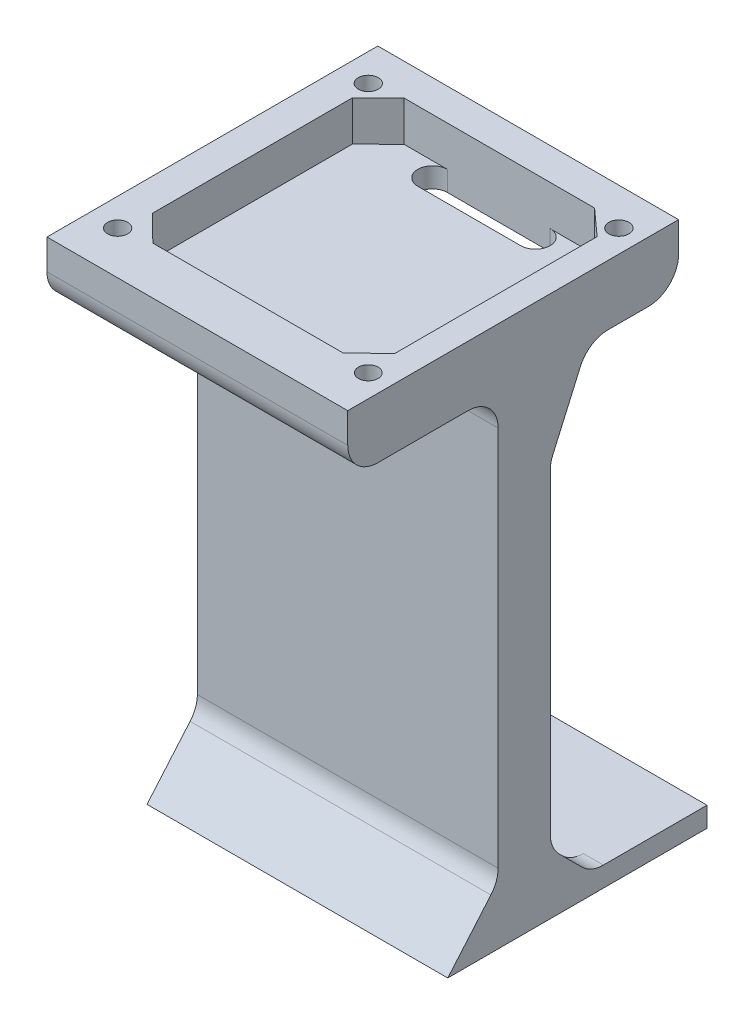
from build123d import *

# Parameters (mm, degrees)
SKETCH_1_W           = 30
SKETCH_1_H           = 50
EXTRUDE_1_DEPTH      = 3
EXTRUDE_2_DEPTH      = 30
EXTRUDE_3_DEPTH      = 15
EXTRUDE_3_DEPTH_BACK = 18
SKETCH_3_W           = 3.207439814
SKETCH_3_H           = 4
SKETCH_3_W_2         = 2.592560186
SKETCH_4_W           = 33
SKETCH_4_H           = 2
EXTRUDE_4_DEPTH      = 30
EXTRUDE_5_DEPTH      = 4
CUT_EXTRUDE_1_DEPTH  = 5
SKETCH_7_R           = 1
SKETCH_7_R_2         = 0.983708166
CUT_EXTRUDE_2_DEPTH  = 5
FILLET_1_R           = 3
FILLET_2_R           = 3
EXTRUDE_6_DEPTH      = 2
FILLET_3_R           = 3
FILLET_4_R           = 3


with BuildPart() as part:
    # 草图1 → 凸台-拉伸1 (new body)
    with BuildSketch(Plane.XY):
        with Locations((-0.718788486, 5)):
            Rectangle(SKETCH_1_W, SKETCH_1_H)
    extrude(amount=EXTRUDE_1_DEPTH)

    # 草图2 → 凸台-拉伸2 (add)
    with BuildSketch(Plane.ZY.offset(15.718788486)):
        Polygon((0, -18.003627417), (-17.838069007, -18.003627417), (-17.838069007, -20), (8.023023193, -20), (3, -14.134137312), align=None)
    extrude(amount=-EXTRUDE_2_DEPTH)

    # 草图3 → 凸台-拉伸3 (add, two sides: drawn at the far end of the back side and taken through both)
    with BuildSketch(Plane.XY.offset(3).offset(-EXTRUDE_3_DEPTH_BACK)):
        with Locations((-14.115068579, 32)):
            Rectangle(SKETCH_3_W, SKETCH_3_H)
        with Locations((12.984931421, 32)):
            Rectangle(SKETCH_3_W_2, SKETCH_3_H)
    extrude(amount=EXTRUDE_3_DEPTH + EXTRUDE_3_DEPTH_BACK)

    # 草图4 → 凸台-拉伸4 (add)
    with BuildSketch(Plane.ZY.offset(15.718788486)):
        with Locations((1.5, 29)):
            Rectangle(SKETCH_4_W, SKETCH_4_H)
    extrude(amount=-EXTRUDE_4_DEPTH)

    # 草图5 → 凸台-拉伸5 (add)
    with BuildSketch(Plane(origin=(0, 30, 0), x_dir=(1, 0, 0), z_dir=(0, 1, 0))):
        Polygon((11.688651328, -18), (-12.511348672, -18), (-12.511348672, -10.700066454), (-9.911348672, -13.250066454), (9.088651328, -13.250066454), (11.688651328, -10.700066454), align=None)
        Polygon((-12.511348672, 15), (-12.511348672, 9.252839713), (-9.911348672, 11.813752042), (9.088651328, 11.813752042), (11.688651328, 9.466986357), (11.688651328, 12.549933546), (11.688651328, 15), align=None)
    extrude(amount=EXTRUDE_5_DEPTH)

    # 草图6 → 切除-拉伸1 (cut)
    with BuildSketch(Plane(origin=(0, 30, 0), x_dir=(1, 0, 0), z_dir=(0, 1, 0))):
        with BuildLine():
            Line((4.654057322, 8.877034891), (-5.604351552, 8.877034891))
            ThreePointArc((-5.604351552, 8.877034891), (-7.072710128, 10.345393466), (-5.604351552, 11.813752042))
            Line((-5.604351552, 11.813752042), (4.654057322, 11.813752042))
            ThreePointArc((4.654057322, 11.813752042), (6.122415898, 10.345393466), (4.654057322, 8.877034891))
        make_face()
    extrude(amount=-CUT_EXTRUDE_1_DEPTH, mode=Mode.SUBTRACT)

    # 草图7 → 切除-拉伸2 (cut)
    with BuildSketch(Plane(origin=(0, 34, 0), x_dir=(1, 0, 0), z_dir=(0, 1, 0))):
        with Locations(Location((-12.963376937, -13.707969551, 0), (0, 0, 270))):
            Circle(SKETCH_7_R)
        with Locations(Location((12.036623063, -13.707969551, 0), (0, 0, 270))):
            Circle(SKETCH_7_R_2)
        with Locations(Location((12.036623063, 11.292030449, 0), (0, 0, 270))):
            Circle(SKETCH_7_R)
        with Locations(Location((-12.963376937, 11.292030449, 0), (0, 0, 270))):
            Circle(SKETCH_7_R)
    extrude(amount=-CUT_EXTRUDE_2_DEPTH, mode=Mode.SUBTRACT)

    # 圆角1
    fillet_1_edges = [part.edges().sort_by_distance(p)[0] for p in [
        (-0.718788486, 28, -15),
        (-0.718788486, 28, 18),
    ]]
    fillet(fillet_1_edges, radius=FILLET_1_R)

    # 圆角2
    fillet_2_edges = [part.edges().sort_by_distance(p)[0] for p in [
        (-0.718788486, 28, 3),
    ]]
    fillet(fillet_2_edges, radius=FILLET_2_R)

    # 草图11 → 凸台-拉伸6 (add)
    with BuildSketch(Plane(origin=(14.281211514, 0, 0), x_dir=(0, 0, -1), z_dir=(1, 0, 0))):
        Polygon((6, 28), (2.205685264, 19.382557308), (2.205685264, -13.954926573), (6.254386108, -18.003627417), (0, -18.003627417), (0, 28), align=None)
    extrude(amount=-EXTRUDE_6_DEPTH)

    # 圆角3
    fillet_3_edges = [part.edges().sort_by_distance(p)[0] for p in [
        (13.281211514, 28, -6),
        (13.281211514, 19.382557308, -2.205685264),
        (13.281211514, -13.954926573, -2.205685264),
        (13.281211514, -18.003627417, -6.254386108),
    ]]
    fillet(fillet_3_edges, radius=FILLET_3_R)

    # 圆角4
    fillet_4_edges = [part.edges().sort_by_distance(p)[0] for p in [
        (-0.718788486, -14.134137312, 3),
    ]]
    fillet(fillet_4_edges, radius=FILLET_4_R)


solid = part.part
